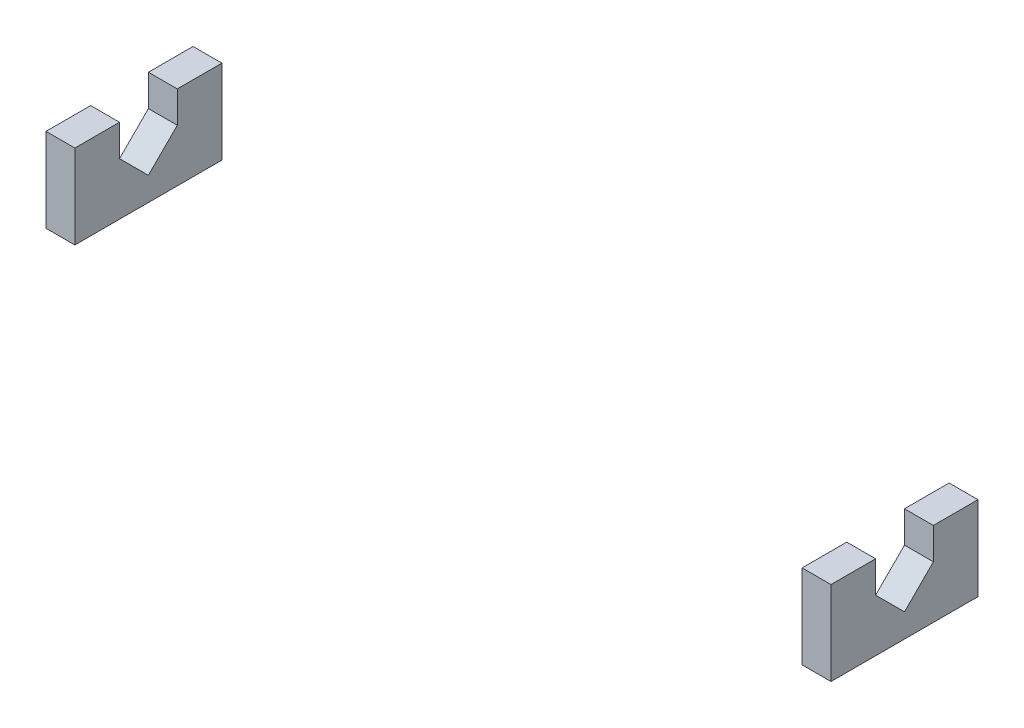
from build123d import *

# Parameters (mm, degrees)
BOSS_EXTRUDE1_DEPTH = 17.4625
LPATTERN1_COUNT     = 2
LPATTERN1_PITCH     = 457.2


with BuildPart() as part:
    # Sketch1 → Boss-Extrude1 (new body)
    with BuildSketch(Plane(origin=(0, 0, 0), x_dir=(0, -1, 0), z_dir=(1, 0, 0))):
        Polygon((-31.75, 26.9875), (-14.2875, 44.45), (-31.75, 61.9125), (-50.8, 61.9125), (-50.8, 88.9), (0, 88.9), (0, 0), (-50.8, 0), (-50.8, 26.9875), align=None)
    extrude(amount=BOSS_EXTRUDE1_DEPTH)


with BuildPart() as lpattern1_1:
    # LPattern1: pattern copy
    add(part.part.moved(Location(Vector(1, 0, 0) * (1 * LPATTERN1_PITCH))))


solid = Compound([part.part, lpattern1_1.part])
